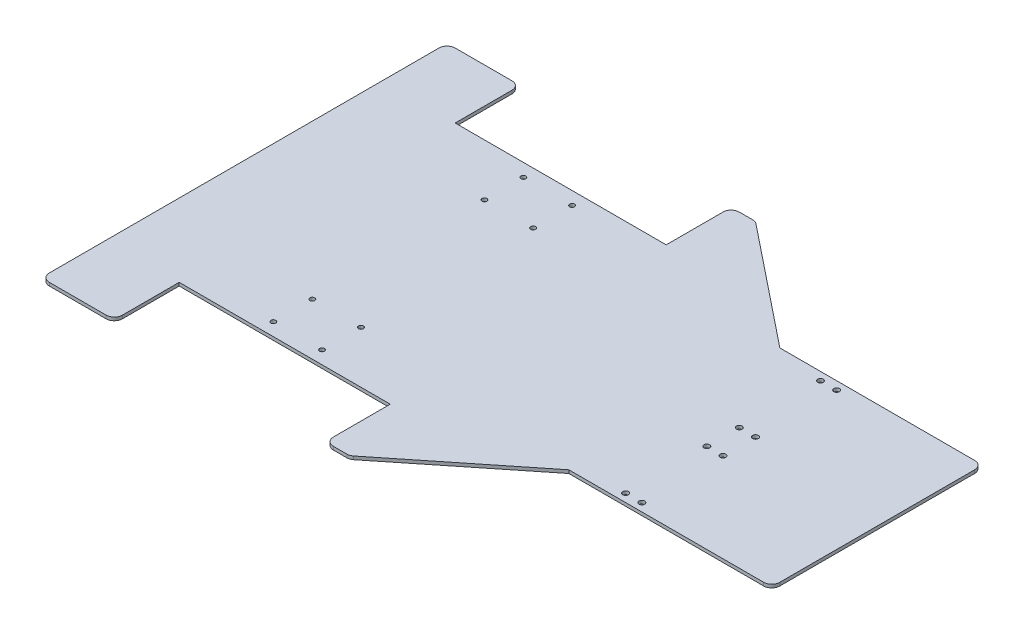
from build123d import *

# Parameters (mm, degrees)
SKETCH_1_W          = 390
SKETCH_1_H          = 250
EXTRUDE_1_DEPTH     = 2
SKETCH_2_W          = 130
SKETCH_2_H          = 40
SKETCH_2_W_2        = 125
SKETCH_2_H_2        = 60
CUT_EXTRUDE_1_DEPTH = 5
CUT_EXTRUDE_2_DEPTH = 10
FILLET_1_R          = 5
SKETCH_4_R          = 1.5
SKETCH_4_R_2        = 1.75
CUT_EXTRUDE_3_DEPTH = 232.633330935


with BuildPart() as part:
    # 스케치1 → 보스-돌출1 (new body)
    with BuildSketch(Plane(origin=(0, 0, 0), x_dir=(1, 0, 0), z_dir=(0, 1, 0))):
        Rectangle(SKETCH_1_W, SKETCH_1_H)
    extrude(amount=EXTRUDE_1_DEPTH)

    # 스케치2 → 컷-돌출1 (cut)
    with BuildSketch(Plane(origin=(0, 2, 0), x_dir=(1, 0, 0), z_dir=(0, 1, 0))):
        with Locations((-85, 105)):
            Rectangle(SKETCH_2_W, SKETCH_2_H)
        with Locations((-85, -105)):
            Rectangle(SKETCH_2_W, SKETCH_2_H)
        with Locations((132.5, 95)):
            Rectangle(SKETCH_2_W_2, SKETCH_2_H_2)
        with Locations((132.5, -95)):
            Rectangle(SKETCH_2_W_2, SKETCH_2_H_2)
    extrude(amount=-CUT_EXTRUDE_1_DEPTH, mode=Mode.SUBTRACT)

    # 스케치3 → 컷-돌출2 (cut)
    with BuildSketch(Plane(origin=(0, 2, 0), x_dir=(1, 0, 0), z_dir=(0, 1, 0))):
        Polygon((-5, 125), (70, 65), (70, 125), align=None)
        Polygon((70, -65), (-5, -125), (70, -125), align=None)
    extrude(amount=-CUT_EXTRUDE_2_DEPTH, mode=Mode.SUBTRACT)

    # 필렛1
    fillet_1_edges = [part.edges().sort_by_distance(p)[0] for p in [
        (-5, 1, -125),
        (-5, 1, 125),
        (-150, 1, 125),
        (-20, 1, 125),
        (195, 1, -65),
        (195, 1, 65),
        (-150, 1, -125),
        (-20, 1, -125),
        (-195, 1, 125),
        (-195, 1, -125),
    ]]
    fillet(fillet_1_edges, radius=FILLET_1_R)

    # 스케치4 → 컷-돌출3 (cut, through all)
    with BuildSketch(Plane(origin=(0, 2, 0), x_dir=(1, 0, 0), z_dir=(0, 1, 0))):
        with Locations(Location((-100, 77, 0), (0, 0, 270))):
            Circle(SKETCH_4_R)
        with Locations(Location((-70, 77, 0), (0, 0, 270))):
            Circle(SKETCH_4_R)
        with Locations(Location((-70, 53, 0), (0, 0, 270))):
            Circle(SKETCH_4_R)
        with Locations(Location((-100, 53, 0), (0, 0, 270))):
            Circle(SKETCH_4_R)
        with Locations(Location((-100, -53, 0), (0, 0, 90))):
            Circle(SKETCH_4_R)
        with Locations(Location((-70, -53, 0), (0, 0, 90))):
            Circle(SKETCH_4_R)
        with Locations(Location((-70, -77, 0), (0, 0, 90))):
            Circle(SKETCH_4_R)
        with Locations(Location((-100, -77, 0), (0, 0, 90))):
            Circle(SKETCH_4_R)
        with Locations(Location((100, 60, 0), (0, 0, 270))):
            Circle(SKETCH_4_R_2)
        with Locations(Location((110, 60, 0), (0, 0, 270))):
            Circle(SKETCH_4_R_2)
        with Locations(Location((100, 10, 0), (0, 0, 270))):
            Circle(SKETCH_4_R_2)
        with Locations(Location((110, 10, 0), (0, 0, 270))):
            Circle(SKETCH_4_R_2)
        with Locations(Location((100, -10, 0), (0, 0, 270))):
            Circle(SKETCH_4_R_2)
        with Locations(Location((110, -10, 0), (0, 0, 270))):
            Circle(SKETCH_4_R_2)
        with Locations(Location((100, -60, 0), (0, 0, 270))):
            Circle(SKETCH_4_R_2)
        with Locations(Location((110, -60, 0), (0, 0, 270))):
            Circle(SKETCH_4_R_2)
    extrude(amount=-CUT_EXTRUDE_3_DEPTH, mode=Mode.SUBTRACT)


solid = part.part
